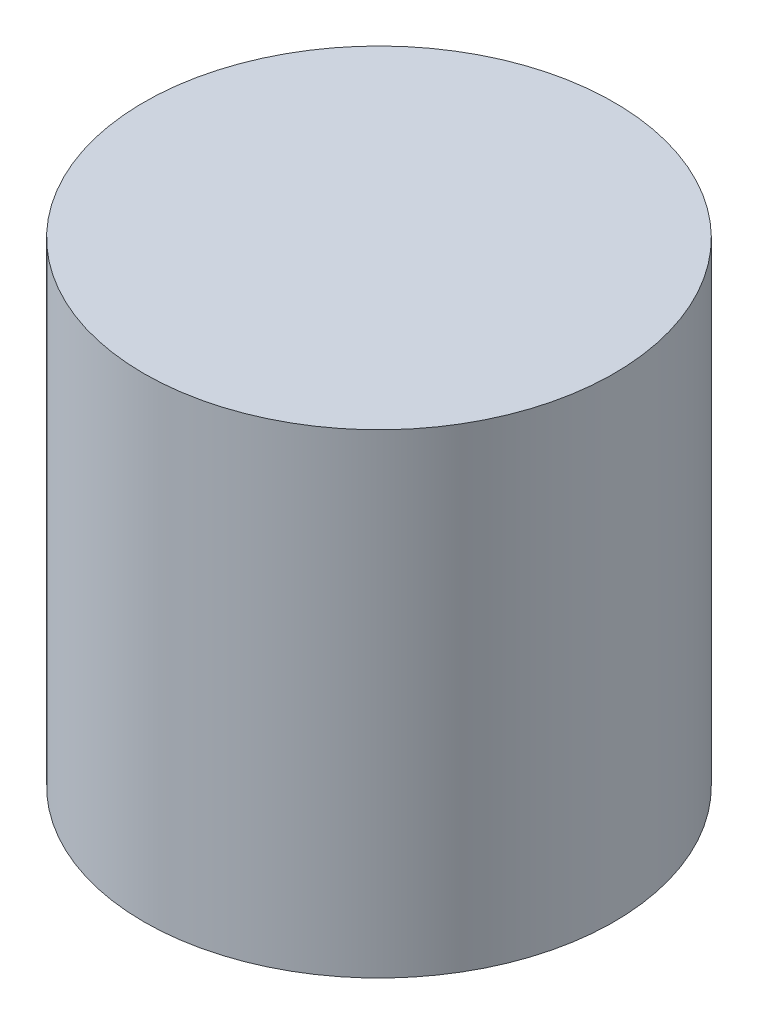
from build123d import *

# Parameters (mm, degrees)
SKETCH1_R           = 9.9
BOSS_EXTRUDE1_DEPTH = 20


with BuildPart() as part:
    # Sketch1 → Boss-Extrude1 (new body)
    with BuildSketch(Plane(origin=(0, 0, 0), x_dir=(1, 0, 0), z_dir=(0, 1, 0))):
        with Locations(Location((0, 0, 0), (0, 0, 270))):
            Circle(SKETCH1_R)
    extrude(amount=BOSS_EXTRUDE1_DEPTH)


solid = part.part
